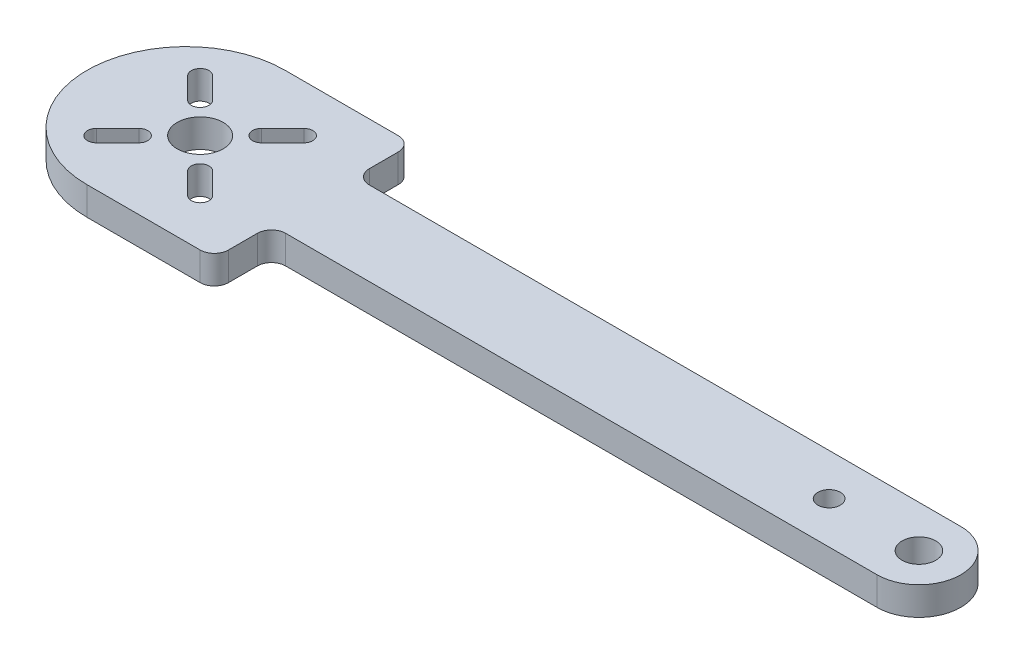
from build123d import *

# Parameters (mm, degrees)
SKETCH1_R           = 3.25
SKETCH1_R_2         = 2.38125
BOSS_EXTRUDE1_DEPTH = 4
SKETCH2_R           = 1.5875
CUT_EXTRUDE1_DEPTH  = 10


with BuildPart() as part:
    # Sketch1 → Boss-Extrude1 (new body)
    with BuildSketch(Plane(origin=(0, 0, 0), x_dir=(1, 0, 0), z_dir=(0, 1, 0))):
        with BuildLine():
            Line((-50.8, 14), (-36.8, 14))
            ThreePointArc((-36.8, 14), (-35.385786438, 13.414213562), (-34.8, 12))
            Line((-34.8, 12), (-34.8, 7.914556152))
            ThreePointArc((-34.8, 7.914556152), (-34.214213562, 6.500342589), (-32.8, 5.914556152))
            Line((-32.8, 5.914556152), (50.8, 5.914556152))
            ThreePointArc((50.8, 5.914556152), (56.714556152, 0), (50.8, -5.914556152))
            Line((50.8, -5.914556152), (-32.8, -5.914556152))
            ThreePointArc((-32.8, -5.914556152), (-34.214213562, -6.500342589), (-34.8, -7.914556152))
            Line((-34.8, -7.914556152), (-34.8, -12))
            ThreePointArc((-34.8, -12), (-35.385786438, -13.414213562), (-36.8, -14))
            Line((-36.8, -14), (-50.8, -14))
            Line((-50.8, -14), (-52.8, -14))
            ThreePointArc((-52.8, -14), (-66.8, 0), (-52.8, 14))
            Line((-52.8, 14), (-50.8, 14))
        make_face()
        with Locations(Location((-50.8, 0, 0), (0, 0, 270))):
            Circle(SKETCH1_R, mode=Mode.SUBTRACT)
        with Locations(Location((50.8, 0, 0), (0, 0, 270))):
            Circle(SKETCH1_R_2, mode=Mode.SUBTRACT)
        with BuildLine():
            Line((-57.252349378, 8.220116331), (-54.247145558, 5.214912511))
            ThreePointArc((-54.247145558, 5.214912511), (-54.247145558, 3.447145558), (-56.014912511, 3.447145558))
            Line((-56.014912511, 3.447145558), (-59.020116331, 6.452349378))
            ThreePointArc((-59.020116331, 6.452349378), (-59.020116331, 8.220116331), (-57.252349378, 8.220116331))
        make_face(mode=Mode.SUBTRACT)
        with BuildLine():
            Line((-42.579883669, 6.452349378), (-45.585087489, 3.447145558))
            ThreePointArc((-45.585087489, 3.447145558), (-47.352854442, 3.447145558), (-47.352854442, 5.214912511))
            Line((-47.352854442, 5.214912511), (-44.347650622, 8.220116331))
            ThreePointArc((-44.347650622, 8.220116331), (-42.579883669, 8.220116331), (-42.579883669, 6.452349378))
        make_face(mode=Mode.SUBTRACT)
        with BuildLine():
            Line((-44.347650622, -8.220116331), (-47.352854442, -5.214912511))
            ThreePointArc((-47.352854442, -5.214912511), (-47.352854442, -3.447145558), (-45.585087489, -3.447145558))
            Line((-45.585087489, -3.447145558), (-42.579883669, -6.452349378))
            ThreePointArc((-42.579883669, -6.452349378), (-42.579883669, -8.220116331), (-44.347650622, -8.220116331))
        make_face(mode=Mode.SUBTRACT)
        with BuildLine():
            Line((-59.020116331, -6.452349378), (-56.014912511, -3.447145558))
            ThreePointArc((-56.014912511, -3.447145558), (-54.247145558, -3.447145558), (-54.247145558, -5.214912511))
            Line((-54.247145558, -5.214912511), (-57.252349378, -8.220116331))
            ThreePointArc((-57.252349378, -8.220116331), (-59.020116331, -8.220116331), (-59.020116331, -6.452349378))
        make_face(mode=Mode.SUBTRACT)
    extrude(amount=BOSS_EXTRUDE1_DEPTH)

    # Sketch2 → Cut-Extrude1 (cut)
    with BuildSketch(Plane.XZ):
        with Locations(Location((38.1, 0, 0), (0, 0, 270))):
            Circle(SKETCH2_R)
    extrude(amount=-CUT_EXTRUDE1_DEPTH, mode=Mode.SUBTRACT)


solid = part.part
